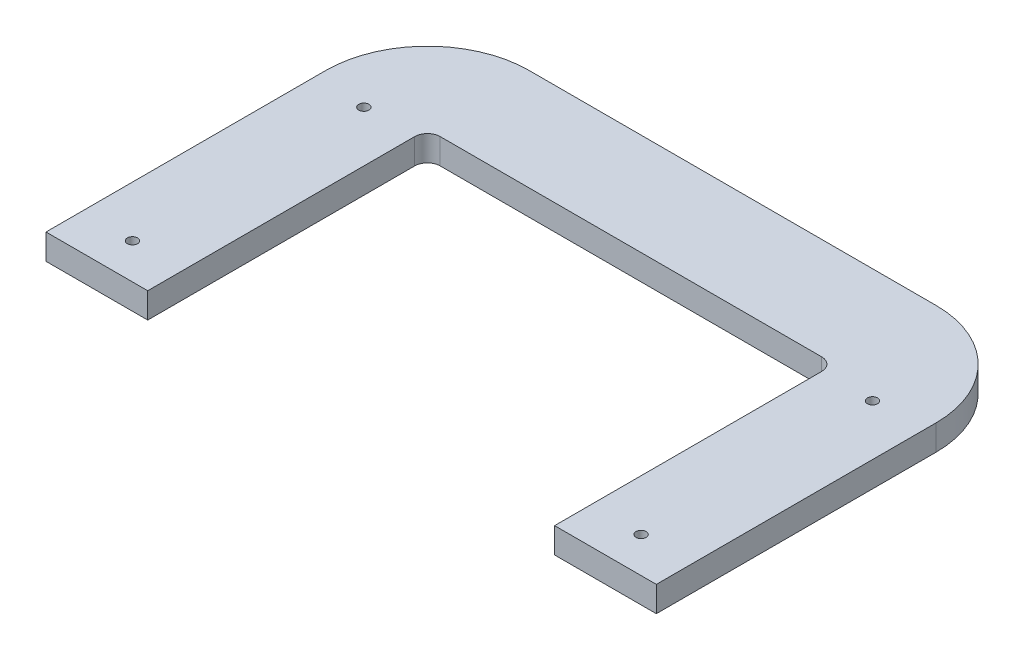
from build123d import *

# Parameters (mm, degrees)
SKETCH_1_R      = 2
EXTRUDE_1_DEPTH = 10
FILLET_1_R      = 40
FILLET_2_R      = 5


with BuildPart() as part:
    # 草图1 → 凸台-拉伸1 (new body)
    with BuildSketch(Plane(origin=(0, 0, 0), x_dir=(1, 0, 0), z_dir=(0, 1, 0))):
        Polygon((-120, 142.125556732), (-120, -7.874443268), (-80, -7.874443268), (-80, 102.125556732), (80, 102.125556732), (80, -7.874443268), (120, -7.874443268), (120, 142.125556732), align=None)
        with Locations(Location((-100, 97.125556732, 0), (0, 0, 270))):
            Circle(SKETCH_1_R, mode=Mode.SUBTRACT)
        with Locations(Location((100, 97.125556732, 0), (0, 0, 90))):
            Circle(SKETCH_1_R, mode=Mode.SUBTRACT)
        with Locations(Location((-100, 6.125556732, 0), (0, 0, 270))):
            Circle(SKETCH_1_R, mode=Mode.SUBTRACT)
        with Locations(Location((100, 6.125556732, 0), (0, 0, 90))):
            Circle(SKETCH_1_R, mode=Mode.SUBTRACT)
    extrude(amount=EXTRUDE_1_DEPTH)

    # 圆角1
    fillet_1_edges = [part.edges().sort_by_distance(p)[0] for p in [
        (-120, 5, -142.125556732),
        (120, 5, -142.125556732),
    ]]
    fillet(fillet_1_edges, radius=FILLET_1_R)

    # 圆角2
    fillet_2_edges = [part.edges().sort_by_distance(p)[0] for p in [
        (80, 5, -102.125556732),
        (-80, 5, -102.125556732),
    ]]
    fillet(fillet_2_edges, radius=FILLET_2_R)


solid = part.part
